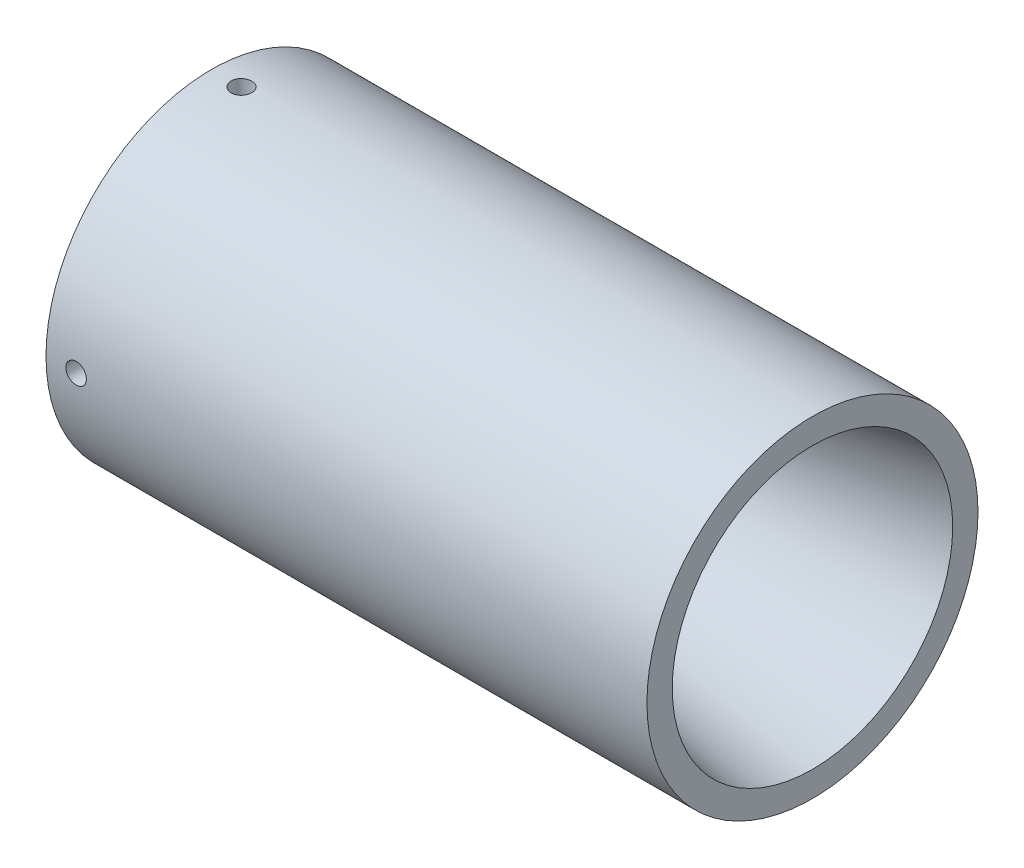
from build123d import *

# Parameters (mm, degrees)
M2_5_TAPPED_HOLE1_D           = 2.05
M2_5_TAPPED_HOLE1_ON_FACE_2_D = 2.05


with BuildPart() as part:
    # Sketch1 → Revolve1 (revolve)
    with BuildSketch(Plane.XY, mode=Mode.PRIVATE) as revolve1_sk:
        Polygon((0, 7.5), (36.519586152, 14), (36.519586152, 16.526331), (-23.480413848, 16.526331), (-23.480413848, 12.526331), align=None)
    revolve(revolve1_sk.sketch.rotate(Axis((-21.926609295, 0, 0), (1, 0, 0)), 90), axis=Axis((-21.926609295, 0, 0), (1, 0, 0)))

    # M2.5 Tapped Hole1 (through all)
    with Locations(Plane(origin=(-20.480413848, 0, -16.526331), x_dir=(0, -1, 0), z_dir=(0, 0, -1))):
        with Locations((0, 0)):
            Hole(M2_5_TAPPED_HOLE1_D / 2)

    # M2.5 Tapped Hole1 on face 2 (through all)
    with Locations(Plane(origin=(-20.480413848, 16.526331, 0), x_dir=(0, 0, 1), z_dir=(0, 1, 0))):
        with Locations((0, 0)):
            Hole(M2_5_TAPPED_HOLE1_ON_FACE_2_D / 2)


solid = part.part
